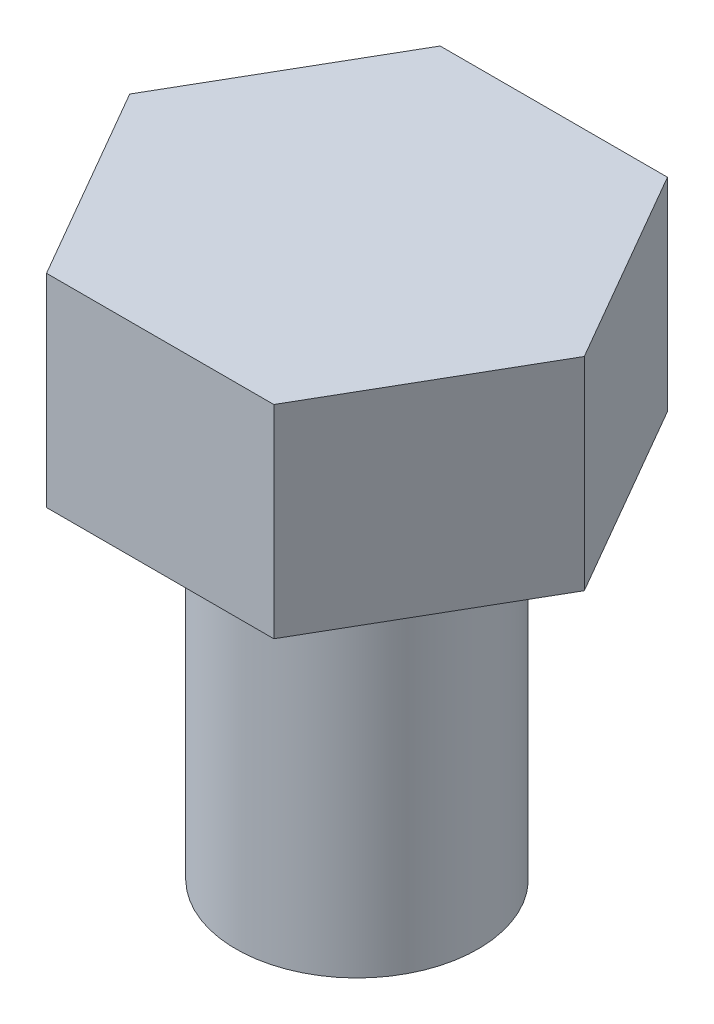
from build123d import *

# Parameters (mm, degrees)
BOSS_EXTRUDE1_DEPTH = 6.7
SKETCH2_R           = 4
BOSS_EXTRUDE2_DEPTH = 12


with BuildPart() as part:
    # Sketch1 → Boss-Extrude1 (new body)
    with BuildSketch(Plane(origin=(0, 0, 0), x_dir=(1, 0, 0), z_dir=(0, 1, 0))):
        Polygon((7.505553499, 0), (3.75277675, 6.5), (-3.75277675, 6.5), (-7.505553499, 0), (-3.75277675, -6.5), (3.75277675, -6.5), align=None)
    extrude(amount=BOSS_EXTRUDE1_DEPTH)

    # Sketch2 → Boss-Extrude2 (add)
    with BuildSketch(Plane.XZ):
        with Locations(Location((0, 0, 0), (0, 0, 270))):
            Circle(SKETCH2_R)
    extrude(amount=BOSS_EXTRUDE2_DEPTH)


solid = part.part
